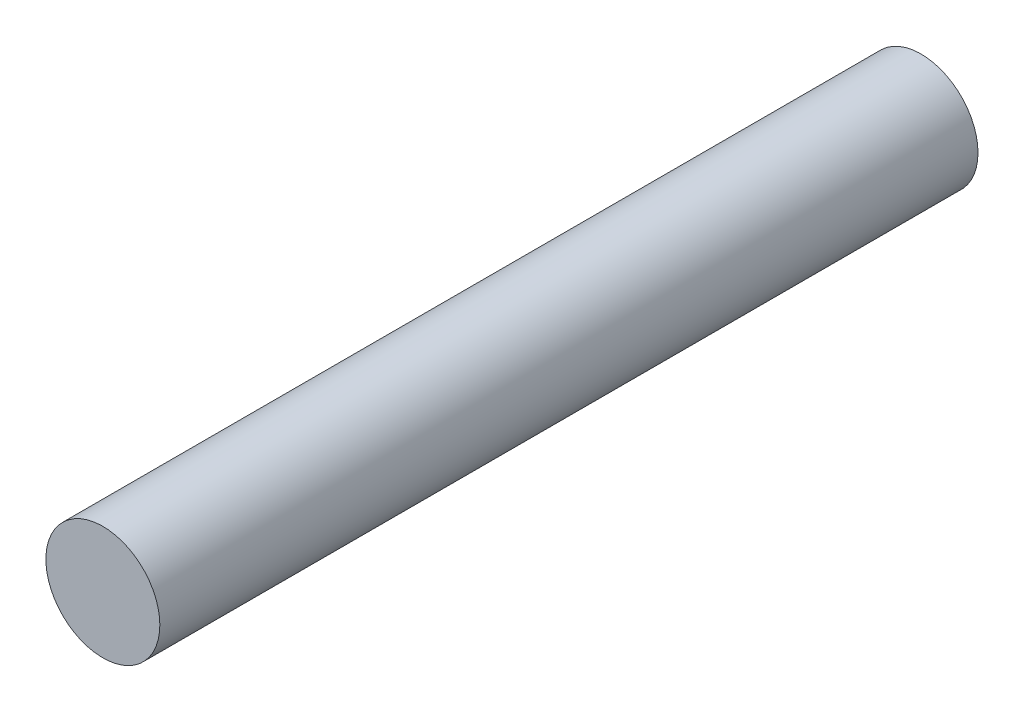
from build123d import *

# Parameters (mm, degrees)
BODY_SKETCH_R = 2.5
BODY_DEPTH    = 35.9


with BuildPart() as part:
    # Body sketch → Body (new body)
    with BuildSketch(Plane.XY):
        Circle(BODY_SKETCH_R)
    extrude(amount=BODY_DEPTH)


solid = part.part
